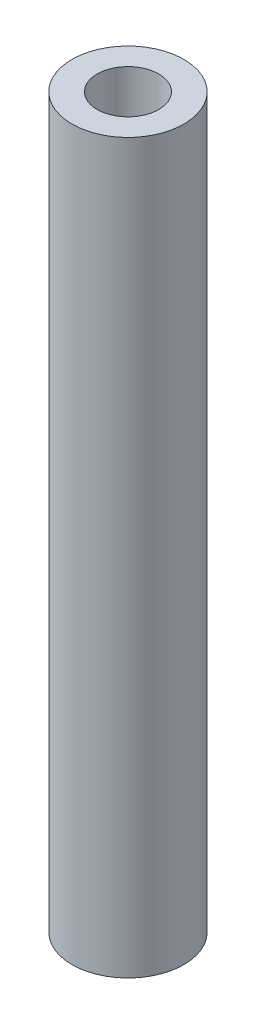
from build123d import *

# Parameters (mm, degrees)
SKETCH_1_R      = 3
SKETCH_1_R_2    = 1.65
EXTRUDE_1_DEPTH = 39


with BuildPart() as part:
    # 草图1 → 凸台-拉伸1 (new body)
    with BuildSketch(Plane(origin=(0, 0, 0), x_dir=(1, 0, 0), z_dir=(0, 1, 0))):
        with Locations(Location((0, 0, 0), (0, 0, 270))):
            Circle(SKETCH_1_R)
        with Locations(Location((0, 0, 0), (0, 0, 270))):
            Circle(SKETCH_1_R_2, mode=Mode.SUBTRACT)
    extrude(amount=EXTRUDE_1_DEPTH)


solid = part.part
